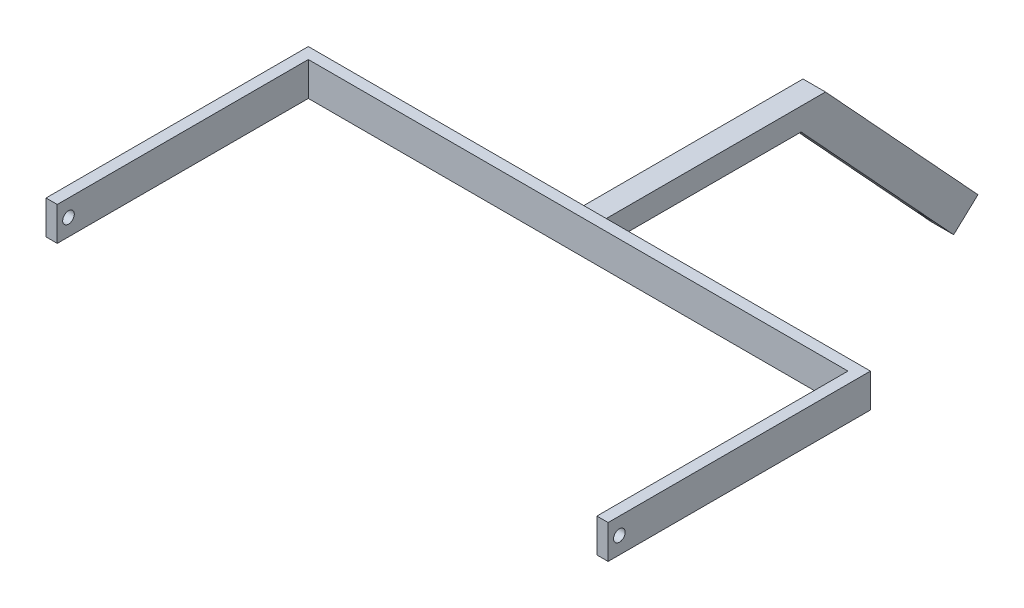
from build123d import *

# Parameters (mm, degrees)
EXTRUDE_2_DEPTH     = 6
SKETCH_2_R          = 1.55
CUT_EXTRUDE_1_DEPTH = 10
SKETCH_3_R          = 1.55
CUT_EXTRUDE_2_DEPTH = 10
EXTRUDE_4_DEPTH     = 1.5
EXTRUDE_5_DEPTH     = 1.5
SKETCH_5_W          = 6
SKETCH_5_H          = 6
EXTRUDE_6_DEPTH     = 60
CUT_EXTRUDE_3_DEPTH = 60
SKETCH_9_W          = 6
SKETCH_9_H          = 8.845903007
EXTRUDE_7_DEPTH     = 60
SKETCH_10_W         = 5
SKETCH_10_H         = 2
CUT_EXTRUDE_4_DEPTH = 10
SKETCH_11_R         = 1.55
CUT_EXTRUDE_5_DEPTH = 10


with BuildPart() as part:
    # 草图1 → 凸台-拉伸2 (new body)
    with BuildSketch(Plane(origin=(0, 0, 0), x_dir=(1, 0, 0), z_dir=(0, 1, 0))):
        Polygon((-72.757575758, -68.484848485), (-72.757575758, -1.484848485), (71.242424242, -1.484848485), (71.242424242, -68.484848485), (74.242424242, -68.484848485), (74.242424242, -1.484848485), (74.242424242, 1.515151515), (71.242424242, 1.515151515), (-72.757575758, 1.515151515), (-75.757575758, 1.515151515), (-75.757575758, -1.484848485), (-75.757575758, -68.484848485), align=None)
    extrude(amount=EXTRUDE_2_DEPTH)

    # 草图2 → 切除-拉伸1 (cut)
    with BuildSketch(Plane(origin=(-72.757575758, 0, 0), x_dir=(0, 0, -1), z_dir=(1, 0, 0))):
        with Locations((-65.484848485, 3)):
            Circle(SKETCH_2_R)
    extrude(amount=-CUT_EXTRUDE_1_DEPTH, mode=Mode.SUBTRACT)

    # 草图3 → 切除-拉伸2 (cut)
    with BuildSketch(Plane(origin=(74.242424242, 0, 0), x_dir=(0, 0, -1), z_dir=(1, 0, 0))):
        with Locations((-65.484848485, 3)):
            Circle(SKETCH_3_R)
    extrude(amount=-CUT_EXTRUDE_2_DEPTH, mode=Mode.SUBTRACT)

    # 草图6 → 凸台-拉伸4 (add)
    with BuildSketch(Plane(origin=(0, 6, 0), x_dir=(1, 0, 0), z_dir=(0, 1, 0))):
        Polygon((-75.757575758, 1.515151515), (74.242424242, 1.515151515), (74.242424242, -68.484848485), (71.242424242, -68.484848485), (71.242424242, -1.484848485), (-72.757575758, -1.484848485), (-72.757575758, -68.484848485), (-75.757575758, -68.484848485), align=None)
    extrude(amount=EXTRUDE_4_DEPTH)

    # 草图7 → 凸台-拉伸5 (add)
    with BuildSketch(Plane.XZ):
        Polygon((-75.757575758, 68.484848485), (-75.757575758, -1.515151515), (74.242424242, -1.515151515), (74.242424242, 68.484848485), (71.242424242, 68.484848485), (71.242424242, 1.484848485), (-72.757575758, 1.484848485), (-72.757575758, 68.484848485), align=None)
    extrude(amount=EXTRUDE_5_DEPTH)

    # 草图5 → 凸台-拉伸6 (add)
    with BuildSketch(Plane(origin=(0, 0, -1.515151515), x_dir=(-1, 0, 0), z_dir=(0, 0, -1))):
        with Locations((0.757575758, 3)):
            Rectangle(SKETCH_5_W, SKETCH_5_H)
    extrude(amount=EXTRUDE_6_DEPTH)

    # 草图8 → 切除-拉伸3 (cut)
    with BuildSketch(Plane(origin=(2.242424242, 0, 0), x_dir=(0, 0, -1), z_dir=(1, 0, 0))):
        Polygon((61.515151515, 6), (55.015151515, 0), (61.515151515, 0), align=None)
    extrude(amount=-CUT_EXTRUDE_3_DEPTH, mode=Mode.SUBTRACT)

    # 草图9 → 凸台-拉伸7 (add)
    with BuildSketch(Plane(origin=(0, -27.419692129, -25.310485042), x_dir=(1, 0, 0), z_dir=(0, -0.7348034446274878, -0.678280102733066))):
        with Locations((-0.757575758, -44.848274344)):
            Rectangle(SKETCH_9_W, SKETCH_9_H)
    extrude(amount=EXTRUDE_7_DEPTH)

    # 草图10 → 切除-拉伸4 (cut)
    with BuildSketch(Plane(origin=(0, -71.507898807, -66.007291206), x_dir=(1, 0, 0), z_dir=(0, -0.7348034446274876, -0.6782801027330662))):
        with Locations((-0.757575758, -44.848274343)):
            Rectangle(SKETCH_10_W, SKETCH_10_H)
    extrude(amount=-CUT_EXTRUDE_4_DEPTH, mode=Mode.SUBTRACT)

    # 草图11 → 切除-拉伸5 (cut)
    with BuildSketch(Plane(origin=(0, 33.419692129, -36.204666473), x_dir=(-1, 0, 0), z_dir=(0, 0.6782801027330662, -0.7348034446274876))):
        with Locations(Location((0.757575758, -90.315682622, 0), (0, 0, 90))):
            Circle(SKETCH_11_R)
    extrude(amount=-CUT_EXTRUDE_5_DEPTH, mode=Mode.SUBTRACT)


solid = part.part
